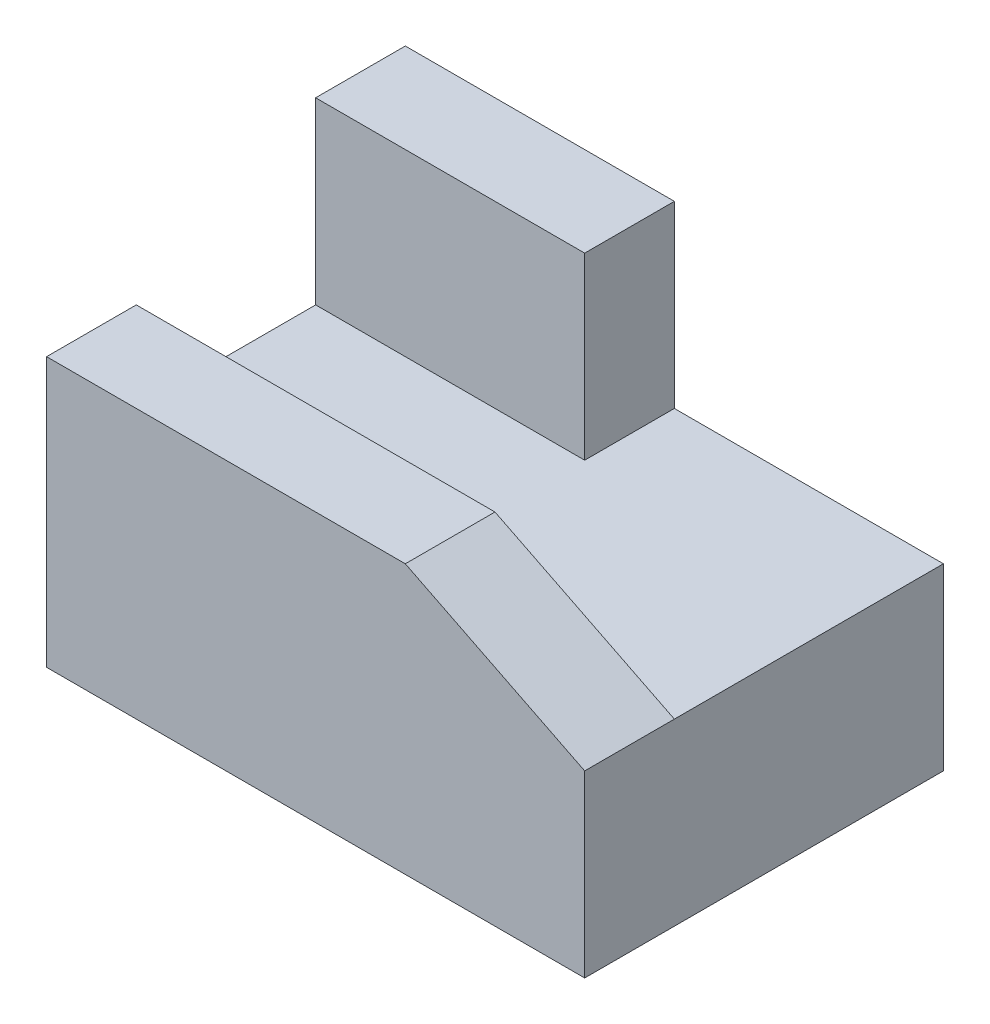
from build123d import *

# Parameters (mm, degrees)
SKETCH_1_W               = 60
SKETCH_1_H               = 40
EXTRUDE_1_DEPTH          = 40
CUT_EXTRUDE_1_DEPTH      = 83.462112512
CUT_EXTRUDE_1_DEPTH_BACK = 83.462112512
CUT_EXTRUDE_2_DEPTH      = 20
SKETCH_5_W               = 10
SKETCH_5_H               = 10
CUT_EXTRUDE_3_DEPTH      = 45


with BuildPart() as part:
    # 草圖1 → 填料-伸長1 (new body)
    with BuildSketch(Plane.XY):
        with Locations((-30, -20)):
            Rectangle(SKETCH_1_W, SKETCH_1_H)
    extrude(amount=EXTRUDE_1_DEPTH)

    # 草圖2 → 除料-伸長1 (cut, two sides: drawn at the far end of the back side and taken through both)
    with BuildSketch(Plane.XY.offset(40).offset(-CUT_EXTRUDE_1_DEPTH_BACK)):
        Polygon((-30, 136.491106407), (-30, 0), (-30, -10), (-20, -10), (0, -20), (122.0813569, -81.04067845), (345.809296059, 75.372549098), (193.727939159, 292.904333955), align=None)
    extrude(amount=CUT_EXTRUDE_1_DEPTH + CUT_EXTRUDE_1_DEPTH_BACK, mode=Mode.SUBTRACT)

    # 草圖4 → 除料-伸長2 (cut)
    with BuildSketch(Plane(origin=(0, 0, 0), x_dir=(1, 0, 0), z_dir=(0, 1, 0))):
        Polygon((-30, 0), (-30, -10), (-60, -10), (-60, -30), (0, -30), (0, 0), align=None)
    extrude(amount=-CUT_EXTRUDE_2_DEPTH, mode=Mode.SUBTRACT)

    # 草圖5 → 除料-伸長3 (cut)
    with BuildSketch(Plane(origin=(-30, 0, 0), x_dir=(0, 0, -1), z_dir=(1, 0, 0))):
        with Locations((-35, -5)):
            Rectangle(SKETCH_5_W, SKETCH_5_H)
    extrude(amount=-CUT_EXTRUDE_3_DEPTH, mode=Mode.SUBTRACT)


solid = part.part
